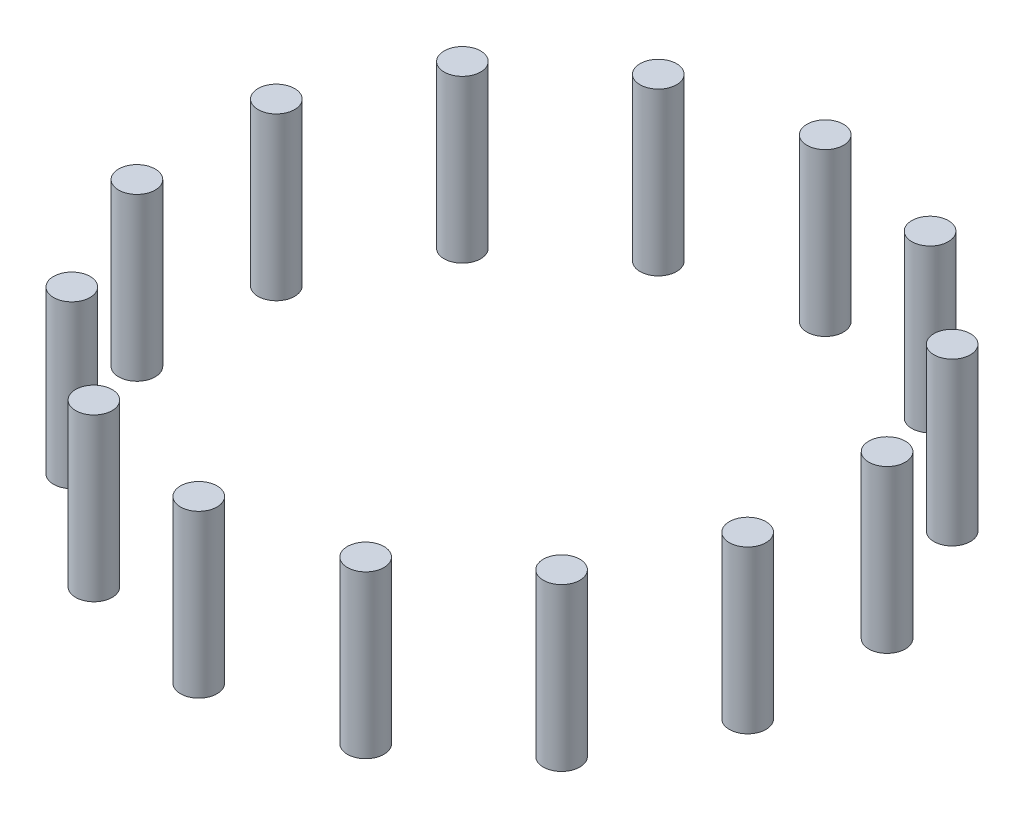
from build123d import *

# Parameters (mm, degrees)
SKETCH1_R              = 0.35
BOSS_EXTRUDE1_DEPTH    = 3.1
BOSS_EXTRUDE1_2_DEPTH  = 3.1
BOSS_EXTRUDE1_3_DEPTH  = 3.1
BOSS_EXTRUDE1_4_DEPTH  = 3.1
BOSS_EXTRUDE1_5_DEPTH  = 3.1
BOSS_EXTRUDE1_6_DEPTH  = 3.1
BOSS_EXTRUDE1_7_DEPTH  = 3.1
BOSS_EXTRUDE1_8_DEPTH  = 3.1
BOSS_EXTRUDE1_9_DEPTH  = 3.1
BOSS_EXTRUDE1_10_DEPTH = 3.1
BOSS_EXTRUDE1_11_DEPTH = 3.1
BOSS_EXTRUDE1_12_DEPTH = 3.1
BOSS_EXTRUDE1_13_DEPTH = 3.1
BOSS_EXTRUDE1_14_DEPTH = 3.1


with BuildPart() as part:
    # Sketch1 → Boss-Extrude1 (new body)
    with BuildSketch(Plane(origin=(0, 0, 0), x_dir=(-1, 0, 0), z_dir=(0, 1, 0))):
        with Locations(Location((0, 6, 0), (0, 0, 90))):
            Circle(SKETCH1_R)
    extrude(amount=BOSS_EXTRUDE1_DEPTH)


with BuildPart() as body_2:
    # Sketch1 → Boss-Extrude1 2 (new body)
    with BuildSketch(Plane(origin=(0, 0, 0), x_dir=(-1, 0, 0), z_dir=(0, 1, 0))):
        with Locations(Location((2.603302435, 5.405813207, 0), (0, 0, 90))):
            Circle(SKETCH1_R)
    extrude(amount=BOSS_EXTRUDE1_2_DEPTH)


with BuildPart() as body_3:
    # Sketch1 → Boss-Extrude1 3 (new body)
    with BuildSketch(Plane(origin=(0, 0, 0), x_dir=(-1, 0, 0), z_dir=(0, 1, 0))):
        with Locations(Location((4.690988895, 3.740938811, 0), (0, 0, 90))):
            Circle(SKETCH1_R)
    extrude(amount=BOSS_EXTRUDE1_3_DEPTH)


with BuildPart() as body_4:
    # Sketch1 → Boss-Extrude1 4 (new body)
    with BuildSketch(Plane(origin=(0, 0, 0), x_dir=(-1, 0, 0), z_dir=(0, 1, 0))):
        with Locations(Location((5.849567473, 1.335125604, 0), (0, 0, 90))):
            Circle(SKETCH1_R)
    extrude(amount=BOSS_EXTRUDE1_4_DEPTH)


with BuildPart() as body_5:
    # Sketch1 → Boss-Extrude1 5 (new body)
    with BuildSketch(Plane(origin=(0, 0, 0), x_dir=(-1, 0, 0), z_dir=(0, 1, 0))):
        with Locations(Location((5.849567473, -1.335125604, 0), (0, 0, 90))):
            Circle(SKETCH1_R)
    extrude(amount=BOSS_EXTRUDE1_5_DEPTH)


with BuildPart() as body_6:
    # Sketch1 → Boss-Extrude1 6 (new body)
    with BuildSketch(Plane(origin=(0, 0, 0), x_dir=(-1, 0, 0), z_dir=(0, 1, 0))):
        with Locations(Location((4.690988895, -3.740938811, 0), (0, 0, 90))):
            Circle(SKETCH1_R)
    extrude(amount=BOSS_EXTRUDE1_6_DEPTH)


with BuildPart() as body_7:
    # Sketch1 → Boss-Extrude1 7 (new body)
    with BuildSketch(Plane(origin=(0, 0, 0), x_dir=(-1, 0, 0), z_dir=(0, 1, 0))):
        with Locations(Location((2.603302435, -5.405813207, 0), (0, 0, 90))):
            Circle(SKETCH1_R)
    extrude(amount=BOSS_EXTRUDE1_7_DEPTH)


with BuildPart() as body_8:
    # Sketch1 → Boss-Extrude1 8 (new body)
    with BuildSketch(Plane(origin=(0, 0, 0), x_dir=(-1, 0, 0), z_dir=(0, 1, 0))):
        with Locations(Location((0, -6, 0), (0, 0, 90))):
            Circle(SKETCH1_R)
    extrude(amount=BOSS_EXTRUDE1_8_DEPTH)


with BuildPart() as body_9:
    # Sketch1 → Boss-Extrude1 9 (new body)
    with BuildSketch(Plane(origin=(0, 0, 0), x_dir=(-1, 0, 0), z_dir=(0, 1, 0))):
        with Locations(Location((-2.603302435, -5.405813207, 0), (0, 0, 90))):
            Circle(SKETCH1_R)
    extrude(amount=BOSS_EXTRUDE1_9_DEPTH)


with BuildPart() as body_10:
    # Sketch1 → Boss-Extrude1 10 (new body)
    with BuildSketch(Plane(origin=(0, 0, 0), x_dir=(-1, 0, 0), z_dir=(0, 1, 0))):
        with Locations(Location((-4.690988895, -3.740938811, 0), (0, 0, 90))):
            Circle(SKETCH1_R)
    extrude(amount=BOSS_EXTRUDE1_10_DEPTH)


with BuildPart() as body_11:
    # Sketch1 → Boss-Extrude1 11 (new body)
    with BuildSketch(Plane(origin=(0, 0, 0), x_dir=(-1, 0, 0), z_dir=(0, 1, 0))):
        with Locations(Location((-5.849567473, -1.335125604, 0), (0, 0, 90))):
            Circle(SKETCH1_R)
    extrude(amount=BOSS_EXTRUDE1_11_DEPTH)


with BuildPart() as body_12:
    # Sketch1 → Boss-Extrude1 12 (new body)
    with BuildSketch(Plane(origin=(0, 0, 0), x_dir=(-1, 0, 0), z_dir=(0, 1, 0))):
        with Locations(Location((-5.849567473, 1.335125604, 0), (0, 0, 90))):
            Circle(SKETCH1_R)
    extrude(amount=BOSS_EXTRUDE1_12_DEPTH)


with BuildPart() as body_13:
    # Sketch1 → Boss-Extrude1 13 (new body)
    with BuildSketch(Plane(origin=(0, 0, 0), x_dir=(-1, 0, 0), z_dir=(0, 1, 0))):
        with Locations(Location((-4.690988895, 3.740938811, 0), (0, 0, 90))):
            Circle(SKETCH1_R)
    extrude(amount=BOSS_EXTRUDE1_13_DEPTH)


with BuildPart() as body_14:
    # Sketch1 → Boss-Extrude1 14 (new body)
    with BuildSketch(Plane(origin=(0, 0, 0), x_dir=(-1, 0, 0), z_dir=(0, 1, 0))):
        with Locations(Location((-2.603302435, 5.405813207, 0), (0, 0, 90))):
            Circle(SKETCH1_R)
    extrude(amount=BOSS_EXTRUDE1_14_DEPTH)


solid = Compound([part.part, body_2.part, body_3.part, body_4.part, body_5.part, body_6.part, body_7.part, body_8.part, body_9.part, body_10.part, body_11.part, body_12.part, body_13.part, body_14.part])
